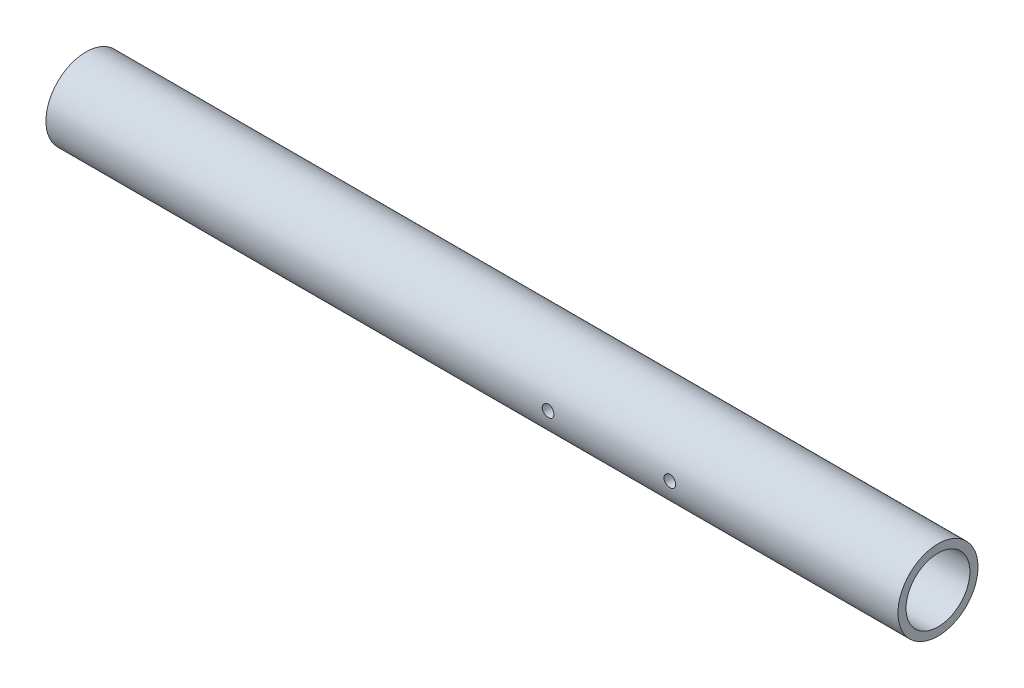
from build123d import *

# Parameters (mm, degrees)
SKETCH1_R               = 16.7005
SKETCH1_R_2             = 13.335
BOSS_EXTRUDE1_DEPTH     = 355.6
CUT_EXTRUDE1_DEPTH      = 357.383463983
CUT_EXTRUDE1_DEPTH_BACK = 357.383463983
SKETCH2_R               = 2.4257


with BuildPart() as part:
    # Sketch1 → Boss-Extrude1 (new body)
    with BuildSketch(Plane(origin=(0, 0, 0), x_dir=(0, 0, -1), z_dir=(1, 0, 0))):
        Circle(SKETCH1_R)
        Circle(SKETCH1_R_2, mode=Mode.SUBTRACT)
    extrude(amount=BOSS_EXTRUDE1_DEPTH)

    # Sketch2 → Cut-Extrude1 (cut, two sides: drawn at the far end of the back side and taken through both)
    with BuildSketch(Plane.XY.offset(-CUT_EXTRUDE1_DEPTH_BACK)):
        with Locations((209.55, 0)):
            Circle(SKETCH2_R)
        with Locations((260.35, 0)):
            Circle(SKETCH2_R)
    extrude(amount=CUT_EXTRUDE1_DEPTH + CUT_EXTRUDE1_DEPTH_BACK, mode=Mode.SUBTRACT)


solid = part.part
